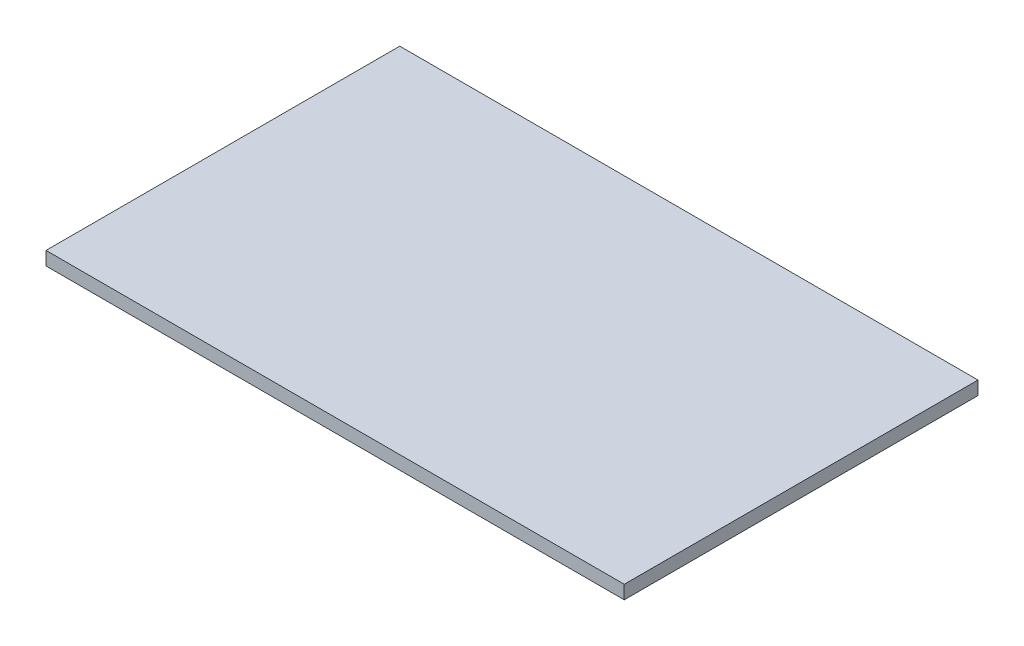
from build123d import *

# Parameters (mm, degrees)
SKETCH1_W           = 85
SKETCH1_H           = 52
BOSS_EXTRUDE1_DEPTH = 1.984375


with BuildPart() as part:
    # Sketch1 → Boss-Extrude1 (new body)
    with BuildSketch(Plane(origin=(0, 0, 0), x_dir=(1, 0, 0), z_dir=(0, 1, 0))):
        with Locations((42.5, 26)):
            Rectangle(SKETCH1_W, SKETCH1_H)
    extrude(amount=BOSS_EXTRUDE1_DEPTH)


solid = part.part
